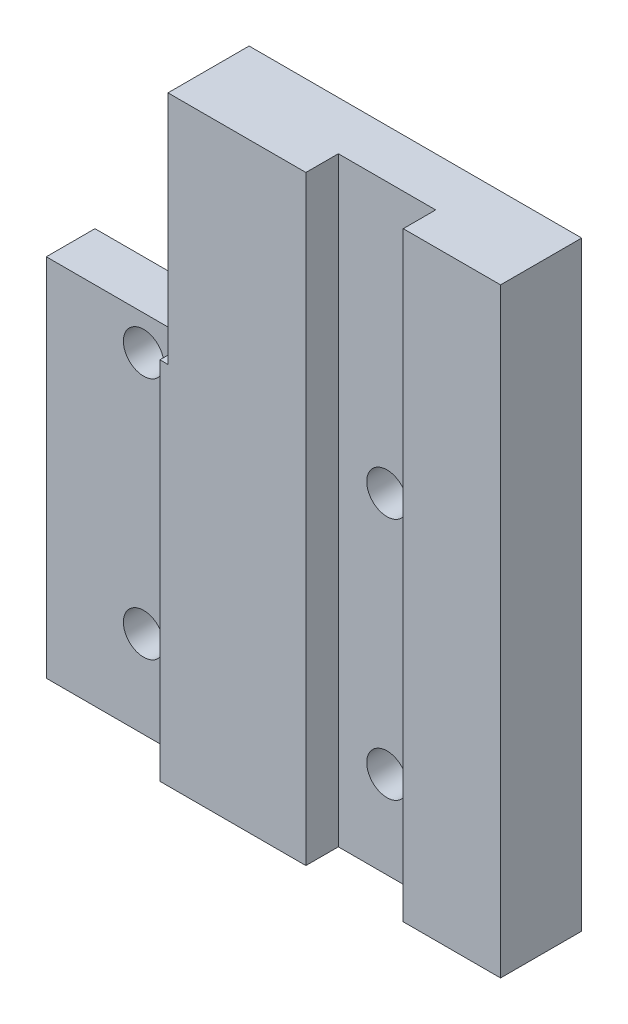
from build123d import *

# Parameters (mm, degrees)
BOSS_EXTRUDE1_DEPTH      = 6
SKETCH2_W                = 12
SKETCH2_H                = 74
SKETCH2_W_2              = 1
SKETCH2_H_2              = 45
BOSS_EXTRUDE2_DEPTH      = 4
F_5_0_5_DIAMETER_HOLE1_D = 5
F_5_0_5_DIAMETER_HOLE2_D = 5


with BuildPart() as part:
    # Sketch1 → Boss-Extrude1 (new body)
    with BuildSketch(Plane.XY):
        Polygon((0, 0), (0, 45), (19, 45), (19, 74), (60, 74), (60, 0), align=None)
    extrude(amount=BOSS_EXTRUDE1_DEPTH)

    # Sketch2 → Boss-Extrude2 (add)
    with BuildSketch(Plane.XY.offset(6)):
        Polygon((36, 0), (36, 74), (19, 74), (19, 45), (19, 0), align=None)
        with Locations((54, 37)):
            Rectangle(SKETCH2_W, SKETCH2_H)
        with Locations((18.5, 22.5)):
            Rectangle(SKETCH2_W_2, SKETCH2_H_2)
    extrude(amount=BOSS_EXTRUDE2_DEPTH)

    # Ø5.0 (5) Diameter Hole1 (through all)
    with Locations(Plane.XY.offset(6)):
        with Locations((42, 40.75), (42, 10.75)):
            Hole(F_5_0_5_DIAMETER_HOLE1_D / 2)

    # Ø5.0 (5) Diameter Hole2 (through all)
    with Locations(Plane.XY.offset(6)):
        with Locations((12, 10.75), (12, 40.75)):
            Hole(F_5_0_5_DIAMETER_HOLE2_D / 2)


solid = part.part
